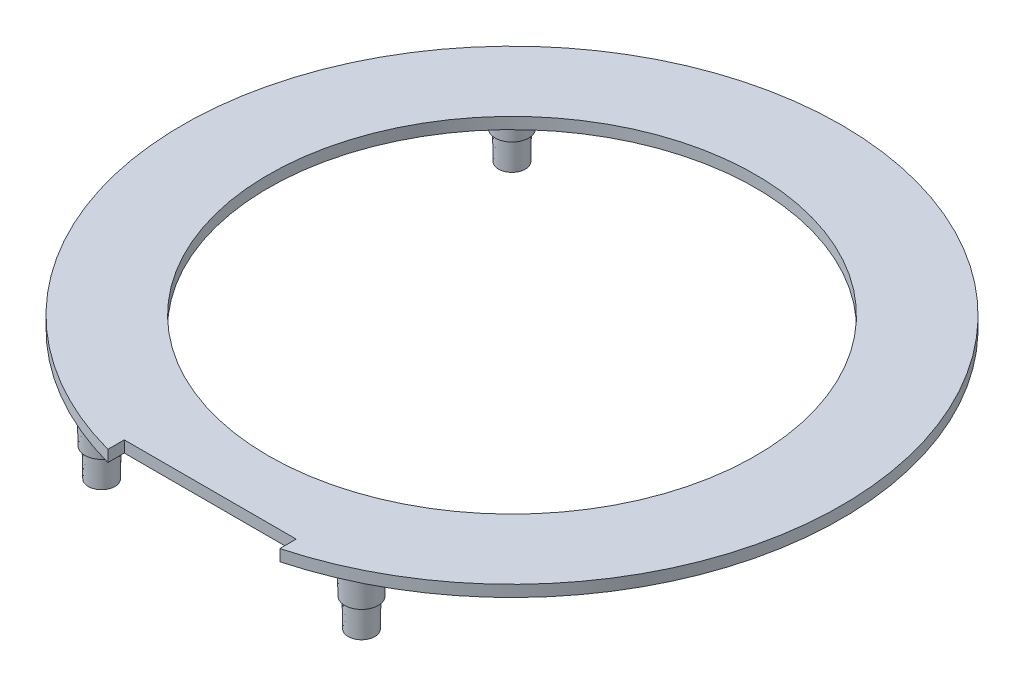
from build123d import *

# Parameters (mm, degrees)
SKETCH1_R           = 11.5
SKETCH1_R_2         = 8.5
BOSS_EXTRUDE1_DEPTH = 0.4
SKETCH2_R           = 0.6
BOSS_EXTRUDE2_DEPTH = 1
SKETCH3_R           = 0.5
BOSS_EXTRUDE3_DEPTH = 1
CUT_EXTRUDE1_START  = -0.4
CUT_EXTRUDE1_DEPTH  = 0.4
DRAFT2_ANGLE        = -1


with BuildPart() as part:
    # Sketch1 → Boss-Extrude1 (new body)
    with BuildSketch(Plane(origin=(0, 0, 0), x_dir=(1, 0, 0), z_dir=(0, 1, 0))):
        with Locations(Location((0, 1.53064501, 0), (0, 0, 270))):
            Circle(SKETCH1_R)
        with Locations(Location((0, 1.53064501, 0), (0, 0, 270))):
            Circle(SKETCH1_R_2, mode=Mode.SUBTRACT)
    extrude(amount=BOSS_EXTRUDE1_DEPTH)

    # Sketch2 → Boss-Extrude2 (add)
    with BuildSketch(Plane(origin=(0, 0, 0), x_dir=(1, 0, 0), z_dir=(0, 1, 0))):
        with Locations(Location((-4.61588, -8.175151, 0), (0, 0, 270))):
            Circle(SKETCH2_R)
        with Locations(Location((-7.04588, 8.574849, 0), (0, 0, 270))):
            Circle(SKETCH2_R)
        with Locations(Location((7.74412, 8.574849, 0), (0, 0, 90))):
            Circle(SKETCH2_R)
        with Locations(Location((4.45412, -8.175151, 0), (0, 0, 90))):
            Circle(SKETCH2_R)
    extrude(amount=-BOSS_EXTRUDE2_DEPTH)

    # Sketch3 → Boss-Extrude3 (add)
    with BuildSketch(Plane.XZ.offset(1)):
        with Locations(Location((-4.61588, 8.175151, 0), (0, 0, 270))):
            Circle(SKETCH3_R)
        with Locations(Location((-7.04588, -8.574849, 0), (0, 0, 270))):
            Circle(SKETCH3_R)
        with Locations(Location((7.74412, -8.574849, 0), (0, 0, 90))):
            Circle(SKETCH3_R)
        with Locations(Location((4.45412, 8.175151, 0), (0, 0, 90))):
            Circle(SKETCH3_R)
    extrude(amount=BOSS_EXTRUDE3_DEPTH)

    # Sketch6 → Cut-Extrude1 (cut)
    with BuildSketch(Plane(origin=(0, 0.4, 0), x_dir=(1, 0, 0), z_dir=(0, 1, 0)).offset(CUT_EXTRUDE1_START)):
        with BuildLine():
            Line((3, -9), (-3, -9))
            Line((-3, -9), (-3, -9.571156646))
            ThreePointArc((-3, -9.571156646), (0, -9.96935499), (3, -9.571156646))
            Line((3, -9.571156646), (3, -9))
        make_face()
    extrude(amount=CUT_EXTRUDE1_DEPTH, mode=Mode.SUBTRACT)

    # Draft2
    draft2_faces = [part.faces().sort_by_distance(p)[0] for p in [
        (7.74412, -1.5, -9.074849),
        (7.74412, -0.5, -7.974849),
        (4.45412, -0.5, 8.775151),
        (4.45412, -1.5, 7.675151),
        (-4.61588, -1.5, 8.675151),
        (-4.61588, -0.5, 7.575151),
        (-7.04588, -0.5, -9.174849),
        (-7.04588, -1.5, -8.074849),
    ]]
    draft(draft2_faces, Plane.ZX, DRAFT2_ANGLE)


solid = part.part
